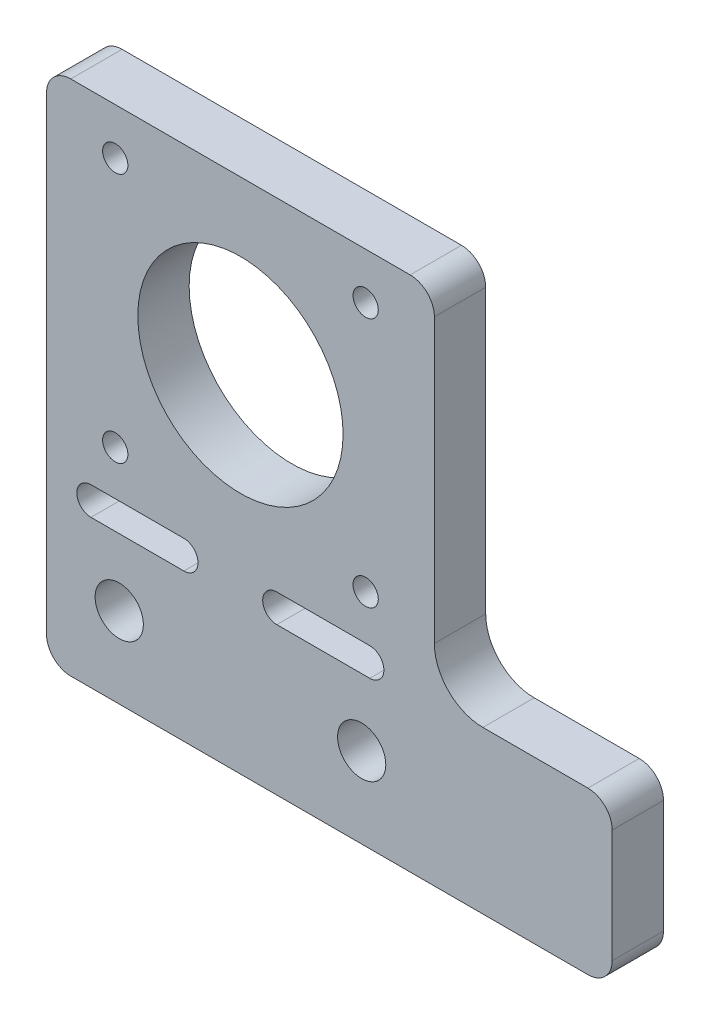
from build123d import *

# Parameters (mm, degrees)
SKETCH1_R           = 2.9845
SKETCH1_R_2         = 1.562499999
SKETCH1_R_3         = 12.7
BOSS_EXTRUDE1_DEPTH = 6.35


with BuildPart() as part:
    # Sketch1 → Boss-Extrude1 (new body)
    with BuildSketch(Plane.XY):
        with BuildLine():
            Line((363.683701588, 169.033854224), (427.683701589, 169.033854224))
            ThreePointArc((427.683701589, 169.033854224), (429.805021933, 169.912533881), (430.68370159, 172.033854225))
            Line((430.68370159, 172.033854225), (430.68370159, 186.033854223))
            ThreePointArc((430.68370159, 186.033854223), (429.805021933, 188.155174567), (427.683701588, 189.033854223))
            Line((427.683701588, 189.033854223), (414.683701589, 189.033854223))
            ThreePointArc((414.683701589, 189.033854223), (410.4410609, 190.791213536), (408.683701587, 195.033854224))
            Line((408.683701587, 195.033854224), (408.683701587, 230.033854224))
            ThreePointArc((408.683701587, 230.033854224), (407.805021931, 232.155174567), (405.683701588, 233.033854223))
            Line((405.683701588, 233.033854223), (363.683701587, 233.033854223))
            ThreePointArc((363.683701587, 233.033854223), (361.562381244, 232.155174567), (360.683701588, 230.033854224))
            Line((360.683701588, 230.033854224), (360.683701588, 172.033854225))
            ThreePointArc((360.683701588, 172.033854225), (361.562381244, 169.912533881), (363.683701588, 169.033854224))
        make_face()
        with Locations((369.683701589, 179.033854223)):
            Circle(SKETCH1_R, mode=Mode.SUBTRACT)
        with Locations((399.683701589, 179.033854223)):
            Circle(SKETCH1_R, mode=Mode.SUBTRACT)
        with Locations((369.189701589, 196.313382783)):
            Circle(SKETCH1_R_2, mode=Mode.SUBTRACT)
        with Locations((400.177701589, 196.313382783)):
            Circle(SKETCH1_R_2, mode=Mode.SUBTRACT)
        with Locations((384.683701589, 211.807382783)):
            Circle(SKETCH1_R_3, mode=Mode.SUBTRACT)
        with Locations((369.189701589, 227.301382783)):
            Circle(SKETCH1_R_2, mode=Mode.SUBTRACT)
        with Locations((400.177701589, 227.301382783)):
            Circle(SKETCH1_R_2, mode=Mode.SUBTRACT)
        with BuildLine():
            Line((366.183701588, 187.299538128), (377.683701588, 187.299538128))
            ThreePointArc((377.683701588, 187.299538128), (379.433701588, 189.049538128), (377.683701588, 190.799538128))
            Line((377.683701588, 190.799538128), (366.183701588, 190.799538128))
            ThreePointArc((366.183701588, 190.799538128), (364.433701588, 189.049538128), (366.183701588, 187.299538128))
        make_face(mode=Mode.SUBTRACT)
        with BuildLine():
            Line((389.183701588, 187.299538128), (400.683701588, 187.299538128))
            ThreePointArc((400.683701588, 187.299538128), (402.433701588, 189.049538128), (400.683701588, 190.799538128))
            Line((400.683701588, 190.799538128), (389.183701588, 190.799538128))
            ThreePointArc((389.183701588, 190.799538128), (387.433701588, 189.049538128), (389.183701588, 187.299538128))
        make_face(mode=Mode.SUBTRACT)
    extrude(amount=BOSS_EXTRUDE1_DEPTH)


solid = part.part
